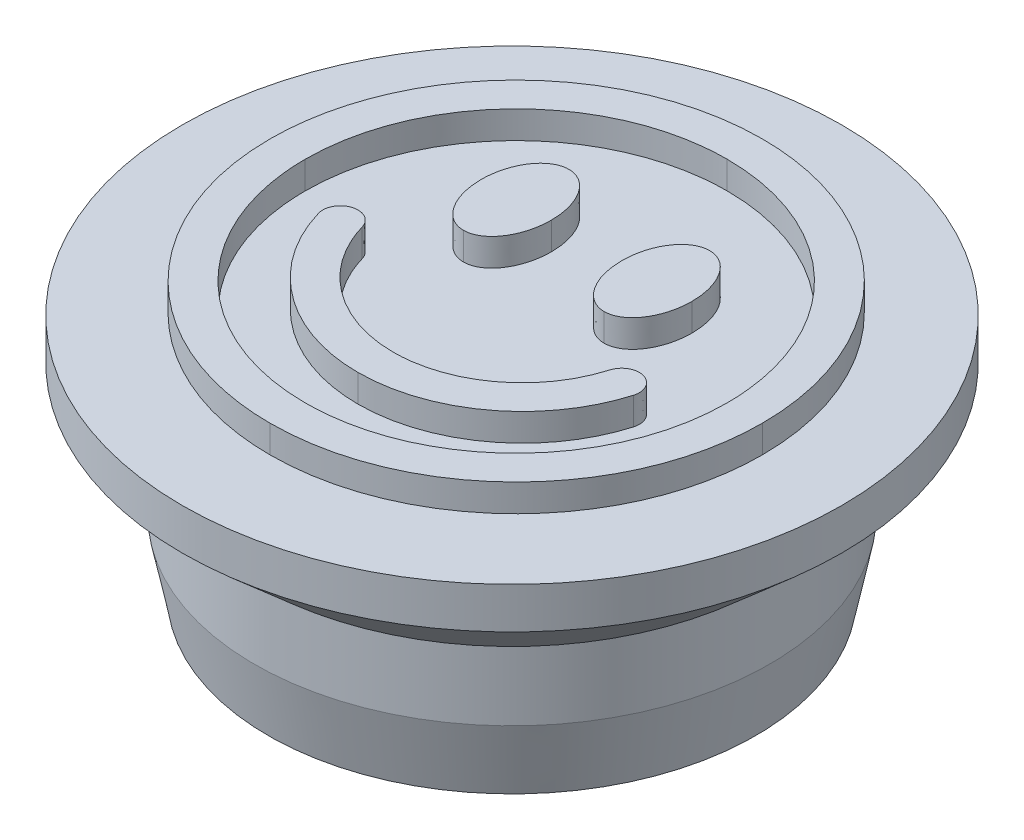
from build123d import *

# Parameters (mm, degrees)
BOSS_EXTRUDE2_DEPTH = 2
CHAMFER1_SIZE       = 1
CHAMFER1_SIZE2      = 5


with BuildPart() as part:
    # Sketch2 → Revolve1 (revolve)
    with BuildSketch(Plane.XY, mode=Mode.PRIVATE) as revolve1_sk:
        Polygon((0, 0), (18.75, 0), (18.75, 10), (24, 14.630064794), (24, 17.630064794), (0, 17.630064794), align=None)
    revolve(revolve1_sk.sketch.rotate(Axis((0, 17.630064794, 0), (0, -1, 0)), 180), axis=Axis((0, 17.630064794, 0), (0, -1, 0)))

    # Sketch3 → Boss-Extrude2 (add)
    # profile 1 of 4: a face of its own
    with BuildSketch(Plane(origin=(0, 17.630064794, 0), x_dir=(1, 0, 0), z_dir=(0, 1, 0))):
        with BuildLine():
            add(Edge.make_bspline(
                [(0, -17.615132118), (9.89752, -17.615132118), (17.92, -9.592652118), (17.92, 0.304867882)],
                knots=[0, 0, 0, 0, 1, 1, 1, 1], degree=3))
            add(Edge.make_bspline(
                [(17.92, 0.304867882), (17.92, 10.202387882), (9.89752, 18.224867882), (0, 18.224867882)],
                knots=[0, 0, 0, 0, 1, 1, 1, 1], degree=3))
            add(Edge.make_bspline(
                [(0, 18.224867882), (-9.89752, 18.224867882), (-17.92, 10.202387882), (-17.92, 0.304867882)],
                knots=[0, 0, 0, 0, 1, 1, 1, 1], degree=3))
            add(Edge.make_bspline(
                [(-17.92, 0.304867882), (-17.92, -9.592652118), (-9.89752, -17.615132118), (0, -17.615132118)],
                knots=[0, 0, 0, 0, 1, 1, 1, 1], degree=3))
        make_face()
        with BuildLine():
            add(Edge.make_bspline(
                [(0, -15.055132118), (-8.47, -15.055132118), (-15.36, -8.165132118), (-15.36, 0.304867882)],
                knots=[0, 0, 0, 0, 1, 1, 1, 1], degree=3))
            add(Edge.make_bspline(
                [(-15.36, 0.304867882), (-15.36, 8.774867882), (-8.47, 15.664867882), (0, 15.664867882)],
                knots=[0, 0, 0, 0, 1, 1, 1, 1], degree=3))
            add(Edge.make_bspline(
                [(0, 15.664867882), (8.47, 15.664867882), (15.36, 8.774867882), (15.36, 0.304867882)],
                knots=[0, 0, 0, 0, 1, 1, 1, 1], degree=3))
            add(Edge.make_bspline(
                [(15.36, 0.304867882), (15.36, -8.165132118), (8.47, -15.055132118), (0, -15.055132118)],
                knots=[0, 0, 0, 0, 1, 1, 1, 1], degree=3))
        make_face(mode=Mode.SUBTRACT)
    # profile 2 of 4: a face of its own
    with BuildSketch(Plane(origin=(0, 17.630064794, 0), x_dir=(1, 0, 0), z_dir=(0, 1, 0))):
        with BuildLine():
            add(Edge.make_bspline(
                [(5.12, 1.584867882), (6.53496, 1.584867882), (7.68, 3.302387882), (7.68, 5.424867882)],
                knots=[0, 0, 0, 0, 1, 1, 1, 1], degree=3))
            add(Edge.make_bspline(
                [(7.68, 5.424867882), (7.68, 7.544867882), (6.53504, 9.264867882), (5.12, 9.264867882)],
                knots=[0, 0, 0, 0, 1, 1, 1, 1], degree=3))
            add(Edge.make_bspline(
                [(5.12, 9.264867882), (3.70496, 9.264867882), (2.56, 7.544867882), (2.56, 5.424867882)],
                knots=[0, 0, 0, 0, 1, 1, 1, 1], degree=3))
            add(Edge.make_bspline(
                [(2.56, 5.424867882), (2.56, 3.302387882), (3.70504, 1.584867882), (5.12, 1.584867882)],
                knots=[0, 0, 0, 0, 1, 1, 1, 1], degree=3))
        make_face()
    # profile 3 of 4: a face of its own
    with BuildSketch(Plane(origin=(0, 17.630064794, 0), x_dir=(1, 0, 0), z_dir=(0, 1, 0))):
        with BuildLine():
            add(Edge.make_bspline(
                [(-5.12, 1.584867882), (-3.70504, 1.584867882), (-2.56, 3.302387882), (-2.56, 5.424867882)],
                knots=[0, 0, 0, 0, 1, 1, 1, 1], degree=3))
            add(Edge.make_bspline(
                [(-2.56, 5.424867882), (-2.56, 7.544867882), (-3.70496, 9.264867882), (-5.12, 9.264867882)],
                knots=[0, 0, 0, 0, 1, 1, 1, 1], degree=3))
            add(Edge.make_bspline(
                [(-5.12, 9.264867882), (-6.53504, 9.264867882), (-7.68, 7.544867882), (-7.68, 5.424867882)],
                knots=[0, 0, 0, 0, 1, 1, 1, 1], degree=3))
            add(Edge.make_bspline(
                [(-7.68, 5.424867882), (-7.68, 3.302387882), (-6.53496, 1.584867882), (-5.12, 1.584867882)],
                knots=[0, 0, 0, 0, 1, 1, 1, 1], degree=3))
        make_face()
    # profile 4 of 4: a face of its own
    with BuildSketch(Plane(origin=(0, 17.630064794, 0), x_dir=(1, 0, 0), z_dir=(0, 1, 0))):
        with BuildLine():
            add(Edge.make_bspline(
                [(0, -11.215132118), (5.27496, -11.215132118), (9.99, -7.677612118), (11.47, -2.612652118)],
                knots=[0, 0, 0, 0, 1, 1, 1, 1], degree=3))
            add(Edge.make_bspline(
                [(11.47, -2.612652118), (11.66752, -1.935132118), (11.27752, -1.225132118), (10.59752, -1.025132118)],
                knots=[0, 0, 0, 0, 1, 1, 1, 1], degree=3))
            add(Edge.make_bspline(
                [(10.59752, -1.025132118), (9.92, -0.822652118), (9.21, -1.220172118), (9.01, -1.895132118)],
                knots=[0, 0, 0, 0, 1, 1, 1, 1], degree=3))
            add(Edge.make_bspline(
                [(9.01, -1.895132118), (7.85, -5.875132118), (4.14504, -8.655132118), (0, -8.655132118)],
                knots=[0, 0, 0, 0, 1, 1, 1, 1], degree=3))
            add(Edge.make_bspline(
                [(0, -8.655132118), (-4.14504, -8.655132118), (-7.85, -5.875132118), (-9.01128, -1.895132118)],
                knots=[0, 0, 0, 0, 1, 1, 1, 1], degree=3))
            add(Edge.make_bspline(
                [(-9.01128, -1.895132118), (-9.2088, -1.220092118), (-9.91128, -0.822652118), (-10.5988, -1.025132118)],
                knots=[0, 0, 0, 0, 1, 1, 1, 1], degree=3))
            add(Edge.make_bspline(
                [(-10.5988, -1.025132118), (-11.27752, -1.225132118), (-11.66632, -1.935132118), (-11.4688, -2.612652118)],
                knots=[0, 0, 0, 0, 1, 1, 1, 1], degree=3))
            add(Edge.make_bspline(
                [(-11.4688, -2.612652118), (-9.99128, -7.677612118), (-5.27496, -11.215132118), (0, -11.215132118)],
                knots=[0, 0, 0, 0, 1, 1, 1, 1], degree=3))
        make_face()
    extrude(amount=BOSS_EXTRUDE2_DEPTH)

    # Chamfer1
    chamfer1_edges = [part.edges().sort_by_distance(p)[0] for p in [
        (18.75, 0, 0),
    ]]
    chamfer1_side = [part.faces().sort_by_distance(p)[0] for p in [
        (0, 0, 0),
    ]]
    chamfer(chamfer1_edges, length=CHAMFER1_SIZE, length2=CHAMFER1_SIZE2, reference=chamfer1_side[0])


solid = part.part
